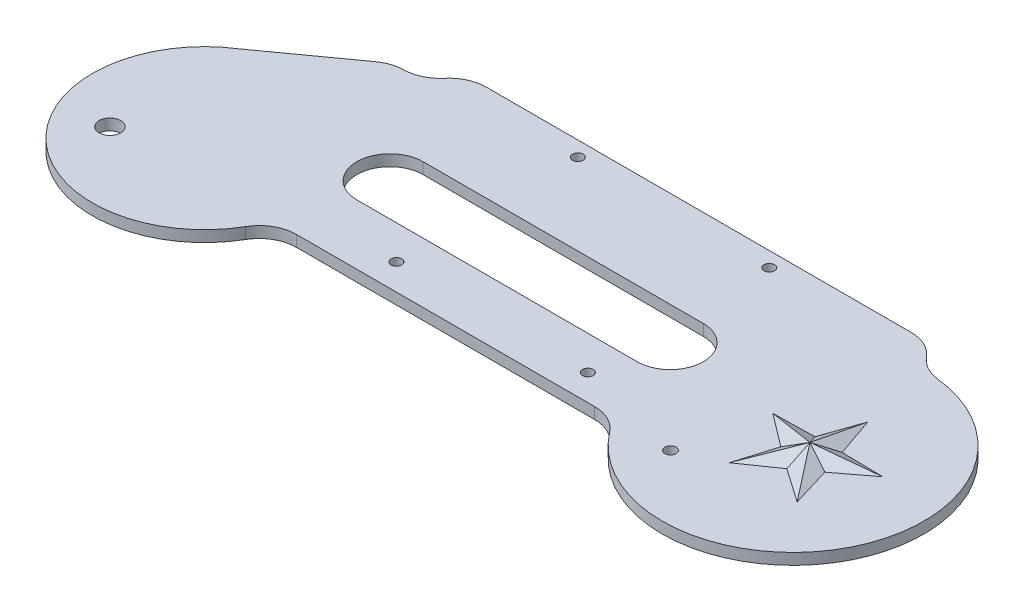
from build123d import *

# Parameters (mm, degrees)
SKETCH1_R           = 2.875
SKETCH1_R_2         = 1.5
BOSS_EXTRUDE1_DEPTH = 3
CUT_EXTRUDE1_DEPTH  = 10
SKETCH3_R           = 1.42
CUT_EXTRUDE2_DEPTH  = 20
FILLET3_R           = 10
FILLET5_R           = 10
FILLET6_R           = 10


with BuildPart() as part:
    # Sketch1 → Boss-Extrude1 (new body)
    with BuildSketch(Plane(origin=(0, 0, 0), x_dir=(1, 0, 0), z_dir=(0, 1, 0))):
        with BuildLine():
            Line((-61.421696796, 42.03125), (-67.039661146, 35))
            Line((-67.039661146, 35), (-74.713671979, 35))
            Line((-74.713671979, 35), (-98.423870832, 17.924994351))
            ThreePointArc((-98.423870832, 17.924994351), (-101.259728964, -30.910949772), (-54.215728753, -17.5))
            Line((-54.215728753, -17.5), (37.189110868, -17.5))
            ThreePointArc((37.189110868, -17.5), (97.810889132, -17.5), (67.5, 35))
            Line((67.5, 35), (61.88203565, 42.03125))
            Line((61.88203565, 42.03125), (-61.421696796, 42.03125))
        make_face()
        with Locations(Location((-97.810889132, -17.5, 0), (0, 0, 270))):
            Circle(SKETCH1_R, mode=Mode.SUBTRACT)
        with Locations(Location((52.189110868, -17.5, 0), (0, 0, 270))):
            Circle(SKETCH1_R_2, mode=Mode.SUBTRACT)
    extrude(amount=BOSS_EXTRUDE1_DEPTH)

    # Sketch2 → Cut-Extrude1 (cut)
    with BuildSketch(Plane(origin=(0, 3, 0), x_dir=(1, 0, 0), z_dir=(0, 1, 0))):
        with BuildLine():
            Line((-47.810889132, 16.294274109), (27.189110868, 16.294274109))
            ThreePointArc((27.189110868, 16.294274109), (36.042740422, 7.440644555), (27.189110868, -1.412984999))
            Line((27.189110868, -1.412984999), (-47.810889132, -1.412984999))
            ThreePointArc((-47.810889132, -1.412984999), (-56.664518687, 7.440644555), (-47.810889132, 16.294274109))
        make_face()
    extrude(amount=-CUT_EXTRUDE1_DEPTH, mode=Mode.SUBTRACT)

    # Sketch3 → Cut-Extrude2 (cut)
    with BuildSketch(Plane(origin=(0, 3, 0), x_dir=(1, 0, 0), z_dir=(0, 1, 0))):
        with Locations(Location((-28.142811364, -10.5, 0), (0, 0, 270))):
            Circle(SKETCH3_R)
        with Locations(Location((23.088594579, -10.5, 0), (0, 0, 270))):
            Circle(SKETCH3_R)
        with Locations(Location((-28.142811364, 38.03125, 0), (0, 0, 270))):
            Circle(SKETCH3_R)
        with Locations(Location((23.088594579, 38.03125, 0), (0, 0, 270))):
            Circle(SKETCH3_R)
    extrude(amount=-CUT_EXTRUDE2_DEPTH, mode=Mode.SUBTRACT)

    # Sketch6 → Loft1 section 0
    with BuildSketch(Plane(origin=(0, 3, 0), x_dir=(1, 0, 0), z_dir=(0, 1, 0)), mode=Mode.PRIVATE) as loft1_s0:
        with BuildLine():
            Line((72, 15.450849719), (75.63271264, 5))
            Line((75.63271264, 5), (86.694631307, 4.774575141))
            Line((86.694631307, 4.774575141), (77.877852523, -1.909830056))
            Line((77.877852523, -1.909830056), (81.0817816, -12.5))
            Line((81.0817816, -12.5), (72, -6.180339887))
            Line((72, -6.180339887), (62.9182184, -12.5))
            Line((62.9182184, -12.5), (66.122147477, -1.909830056))
            Line((66.122147477, -1.909830056), (57.305368693, 4.774575141))
            Line((57.305368693, 4.774575141), (68.36728736, 5))
            Line((68.36728736, 5), (72, 15.450849719))
        make_face()
    loft([Vertex(72, 6, 0), loft1_s0.sketch])

    # Fillet3
    fillet3_edges = [part.edges().sort_by_distance(p)[0] for p in [
        (37.189110868, 1.5, 17.5),
        (-54.215728753, 1.5, 17.5),
    ]]
    fillet(fillet3_edges, radius=FILLET3_R)

    # Fillet5
    fillet5_edges = [part.edges().sort_by_distance(p)[0] for p in [
        (-67.039661146, 1.5, -35),
        (67.5, 1.5, -35),
    ]]
    fillet(fillet5_edges, radius=FILLET5_R)

    # Fillet6
    fillet6_edges = [part.edges().sort_by_distance(p)[0] for p in [
        (61.88203565, 1.5, -42.03125),
        (-61.421696796, 1.5, -42.03125),
        (-74.713671979, 1.5, -35),
    ]]
    fillet(fillet6_edges, radius=FILLET6_R)


solid = part.part
